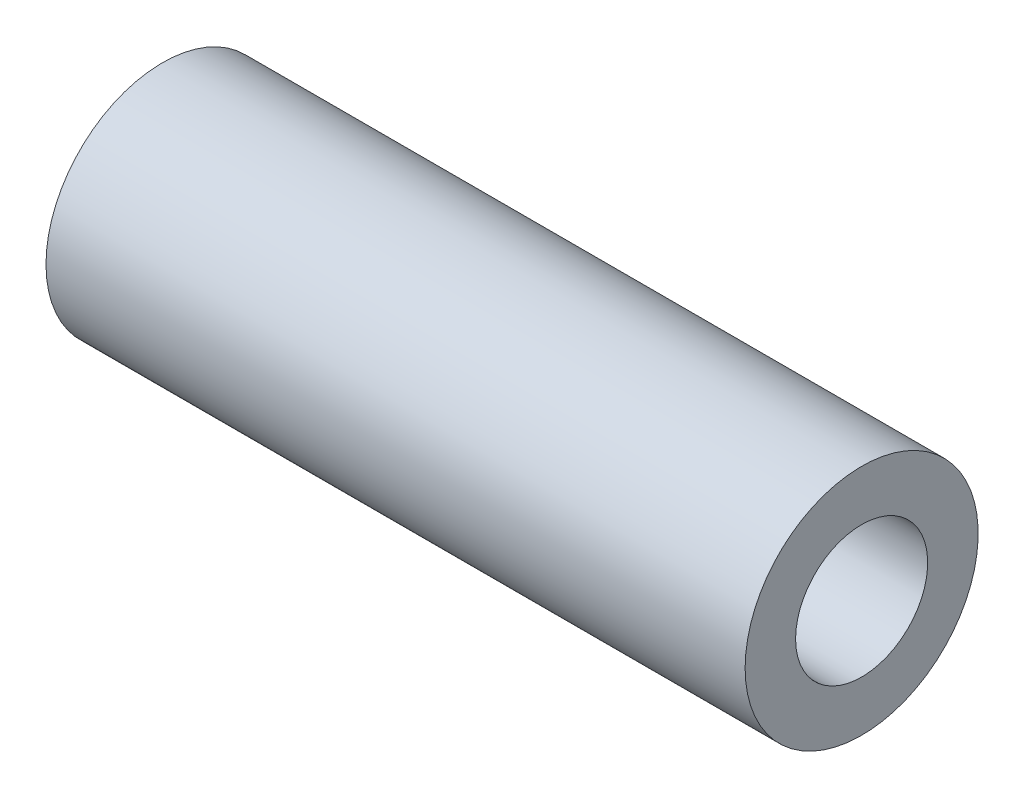
from build123d import *

# Parameters (mm, degrees)
SKETCH1_R           = 3.175
SKETCH1_R_2         = 1.8
BOSS_EXTRUDE1_DEPTH = 19.05


with BuildPart() as part:
    # Sketch1 → Boss-Extrude1 (new body)
    with BuildSketch(Plane(origin=(0, 0, 0), x_dir=(0, 0, -1), z_dir=(1, 0, 0))):
        with Locations(Location((0, 0, 0), (0, 0, 180))):
            Circle(SKETCH1_R)
        with Locations(Location((0, 0, 0), (0, 0, 180))):
            Circle(SKETCH1_R_2, mode=Mode.SUBTRACT)
    extrude(amount=BOSS_EXTRUDE1_DEPTH)


solid = part.part
